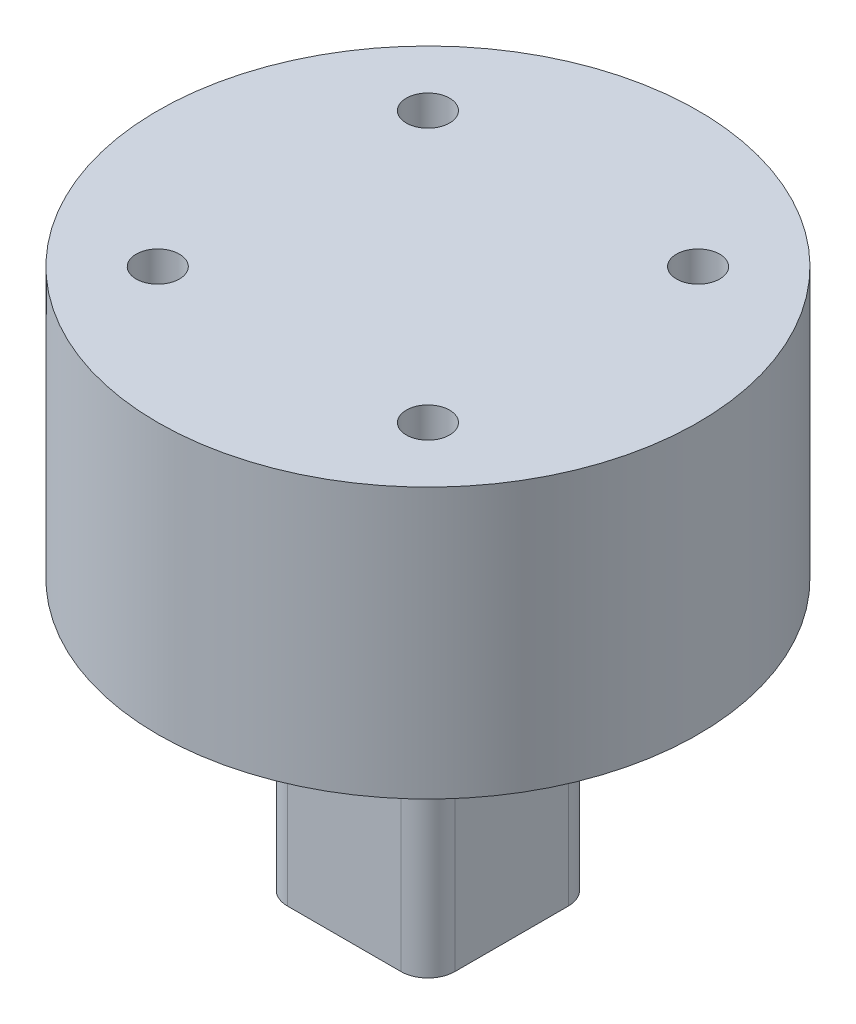
from build123d import *

# Parameters (mm, degrees)
SKETCH1_R             = 10
BOSS_EXTRUDE1_DEPTH   = 10
M2X0_4_TAPPED_HOLE1_D = 1.6
BOSS_EXTRUDE2_DEPTH   = 10


with BuildPart() as part:
    # Sketch1 → Boss-Extrude1 (new body)
    with BuildSketch(Plane(origin=(0, 0, 0), x_dir=(1, 0, 0), z_dir=(0, 1, 0))):
        with Locations(Location((0, 0, 0), (0, 0, 270))):
            Circle(SKETCH1_R)
    extrude(amount=BOSS_EXTRUDE1_DEPTH)

    # M2x0.4 Tapped Hole1 (through all)
    with Locations(Plane(origin=(0, 10, 0), x_dir=(1, 0, 0), z_dir=(0, 1, 0))):
        with Locations((-5, 5), (5, 5), (5, -5), (-5, -5)):
            Hole(M2X0_4_TAPPED_HOLE1_D / 2)

    # Sketch5 → Boss-Extrude2 (add)
    with BuildSketch(Plane.XZ):
        with BuildLine():
            Line((-2.1, 3.1), (2.1, 3.1))
            ThreePointArc((2.1, 3.1), (2.807106781, 2.807106781), (3.1, 2.1))
            Line((3.1, 2.1), (3.1, -2.1))
            ThreePointArc((3.1, -2.1), (2.807106781, -2.807106781), (2.1, -3.1))
            Line((2.1, -3.1), (-2.1, -3.1))
            ThreePointArc((-2.1, -3.1), (-2.807106781, -2.807106781), (-3.1, -2.1))
            Line((-3.1, -2.1), (-3.1, 2.1))
            ThreePointArc((-3.1, 2.1), (-2.807106781, 2.807106781), (-2.1, 3.1))
        make_face()
    extrude(amount=BOSS_EXTRUDE2_DEPTH)


solid = part.part
